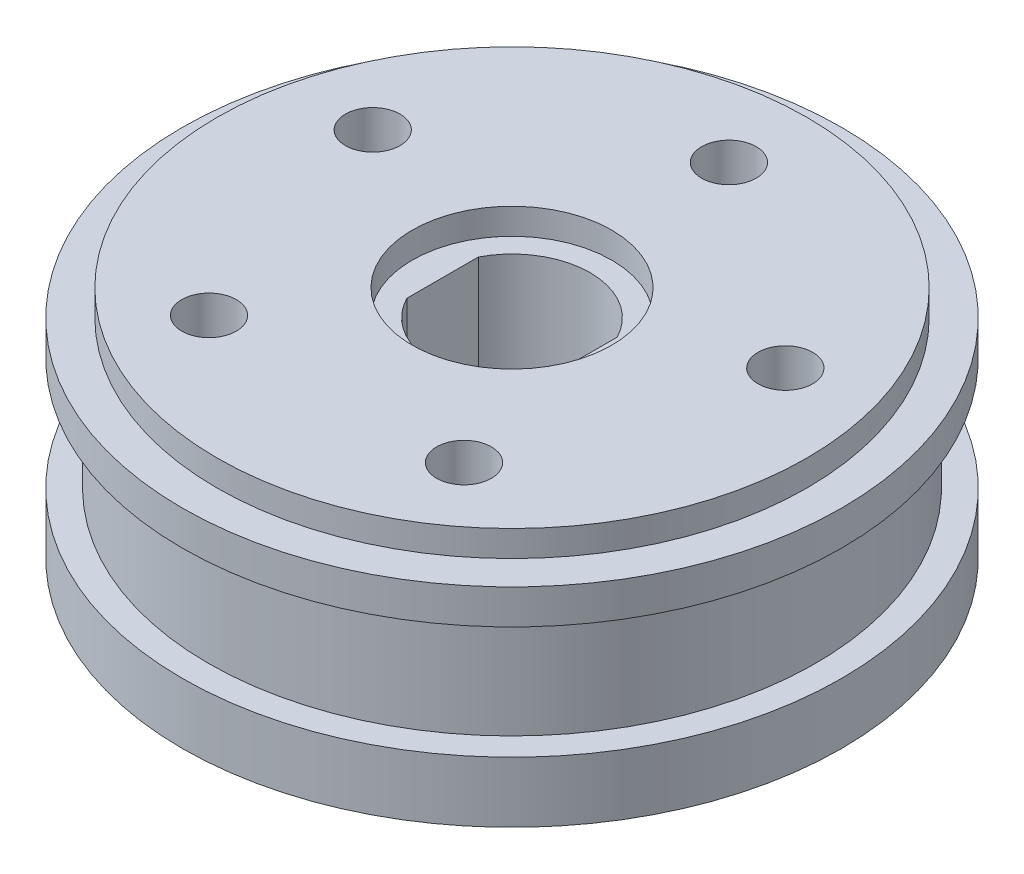
from build123d import *

# Parameters (mm, degrees)
F_9_0_9_DIAMETER_HOLE1_D     = 9
CUT_EXTRUDE1_DEPTH           = 31.070749908
CUT_EXTRUDE1_DEPTH_BACK      = 1.5
SKETCH6_R                    = 5.75
CUT_EXTRUDE2_START           = -12
SKETCH6_2_R                  = 5.75
CUT_EXTRUDE2_DEPTH           = 1.5
BOSS_EXTRUDE1_START          = -10.5
BOSS_EXTRUDE1_DEPTH          = 10.5
TAP_DRILL_FOR_M3_HELICOIL1_D = 3.15
SKETCH11_R                   = 19
SKETCH11_R_2                 = 17
CUT_EXTRUDE3_DEPTH           = 1.5


with BuildPart() as part:
    # Sketch1 → Revolve1 (revolve)
    with BuildSketch(Plane.XY, mode=Mode.PRIVATE) as revolve1_sk:
        Polygon((0, 0), (19, 0), (19, 3.5), (17.5, 3.5), (17.5, 10), (19, 10), (19, 13.5), (0, 13.5), align=None)
    revolve(revolve1_sk.sketch.rotate(Axis((0, 13.5, 0), (0, -1, 0)), 90), axis=Axis((0, 13.5, 0), (0, -1, 0)))

    # Ø9.0 (9) Diameter Hole1 (through all)
    with Locations(Plane(origin=(0, 13.5, 0), x_dir=(1, 0, 0), z_dir=(0, 1, 0))):
        with Locations((0, 0)):
            Hole(F_9_0_9_DIAMETER_HOLE1_D / 2)

    # Sketch6 → Cut-Extrude1 (cut, two sides: drawn at the far end of the back side and taken through both)
    with BuildSketch(Plane(origin=(0, 13.5, 0), x_dir=(1, 0, 0), z_dir=(0, 1, 0)).offset(-CUT_EXTRUDE1_DEPTH_BACK)):
        with Locations(Location((0, 0, 0), (0, 0, 90))):
            Circle(SKETCH6_R)
    extrude(amount=CUT_EXTRUDE1_DEPTH + CUT_EXTRUDE1_DEPTH_BACK, mode=Mode.SUBTRACT)

    # Sketch6<2> → Cut-Extrude2 (cut)
    with BuildSketch(Plane(origin=(0, 13.5, 0), x_dir=(1, 0, 0), z_dir=(0, 1, 0)).offset(CUT_EXTRUDE2_START)):
        with Locations(Location((0, 0, 0), (0, 0, 90))):
            Circle(SKETCH6_2_R)
    extrude(amount=-CUT_EXTRUDE2_DEPTH, mode=Mode.SUBTRACT)

    # Sketch7 → Boss-Extrude1 (add)
    with BuildSketch(Plane(origin=(0, 12, 0), x_dir=(1, 0, 0), z_dir=(0, 1, 0)).offset(BOSS_EXTRUDE1_START)):
        with BuildLine():
            ThreePointArc((-4, 2.061552813), (-4.5, 0), (-4, -2.061552813))
            Line((-4, -2.061552813), (-4, 2.061552813))
        make_face()
        with BuildLine():
            Line((4, 2.061552813), (4, -2.061552813))
            ThreePointArc((4, -2.061552813), (4.373213921, -1.060660172), (4.5, 0))
            ThreePointArc((4.5, 0), (4.373213921, 1.060660172), (4, 2.061552813))
        make_face()
    extrude(amount=BOSS_EXTRUDE1_DEPTH)

    # Tap Drill for M3 Helicoil1 (through all)
    with Locations(Plane(origin=(0, 13.5, 0), x_dir=(1, 0, 0), z_dir=(0, 1, 0))):
        with Locations((-11.888206454, 3.86271243), (0, 12.5), (11.888206454, 3.86271243), (7.347315654, -10.11271243), (-7.347315654, -10.11271243)):
            Hole(TAP_DRILL_FOR_M3_HELICOIL1_D / 2)

    # Sketch11 → Cut-Extrude3 (cut)
    with BuildSketch(Plane(origin=(0, 13.5, 0), x_dir=(1, 0, 0), z_dir=(0, 1, 0))):
        with Locations(Location((0, 0, 0), (0, 0, 270))):
            Circle(SKETCH11_R)
        with Locations(Location((0, 0, 0), (0, 0, 270))):
            Circle(SKETCH11_R_2, mode=Mode.SUBTRACT)
    extrude(amount=-CUT_EXTRUDE3_DEPTH, mode=Mode.SUBTRACT)


solid = part.part
